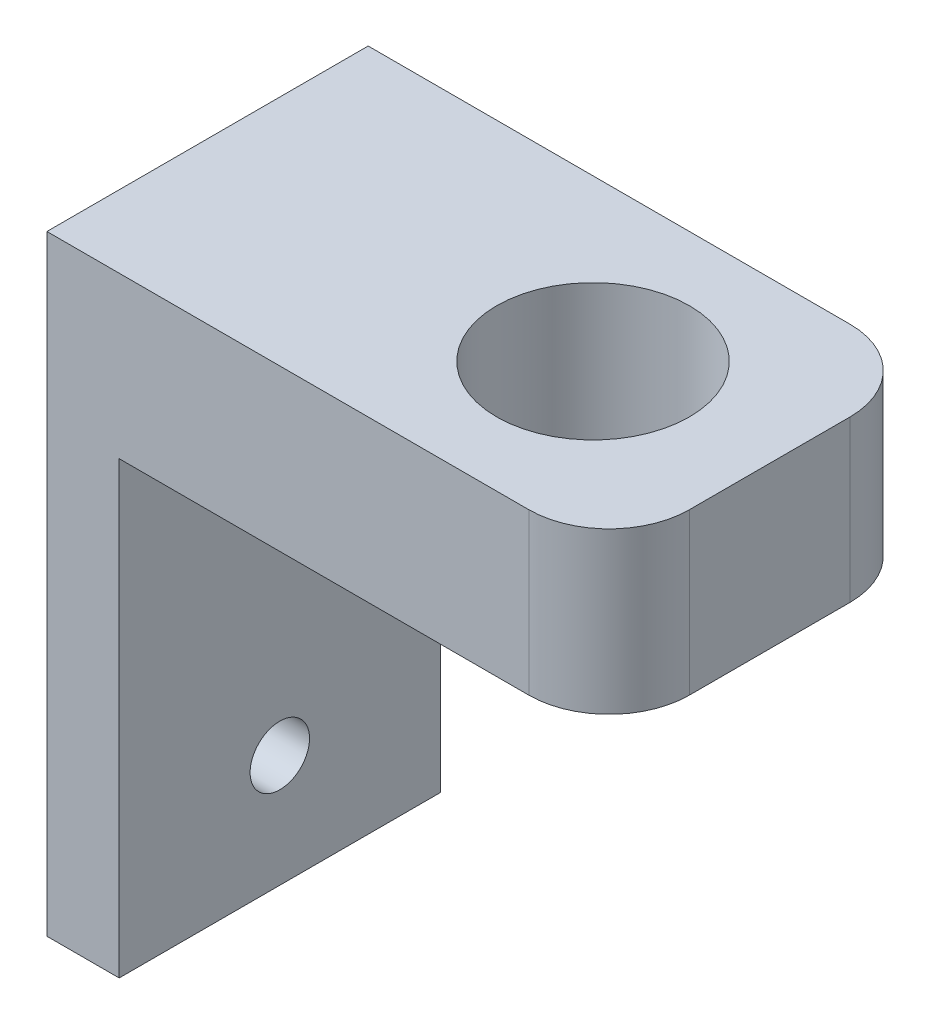
from build123d import *

# Parameters (mm, degrees)
SKETCH1_W           = 35
SKETCH1_H           = 20
BOSS_EXTRUDE1_DEPTH = 10
FILLET1_R           = 5
SKETCH4_R           = 6
CUT_EXTRUDE2_DEPTH  = 23.5
SKETCH5_W           = 4.5
SKETCH5_H           = 20
BOSS_EXTRUDE3_DEPTH = 28
SKETCH6_R           = 1.85
CUT_EXTRUDE3_DEPTH  = 43.594013664


with BuildPart() as part:
    # Sketch1 → Boss-Extrude1 (new body)
    with BuildSketch(Plane(origin=(0, 0, 0), x_dir=(1, 0, 0), z_dir=(0, 1, 0))):
        Rectangle(SKETCH1_W, SKETCH1_H)
    extrude(amount=BOSS_EXTRUDE1_DEPTH)

    # Fillet1
    fillet1_edges = [part.edges().sort_by_distance(p)[0] for p in [
        (17.5, 5, 10),
        (17.5, 5, -10),
    ]]
    fillet(fillet1_edges, radius=FILLET1_R)

    # Sketch4 → Cut-Extrude2 (cut, through all)
    with BuildSketch(Plane(origin=(0, 10, 0), x_dir=(1, 0, 0), z_dir=(0, 1, 0))):
        with Locations(Location((6.5, 0, 0), (0, 0, 270))):
            Circle(SKETCH4_R)
    extrude(amount=-CUT_EXTRUDE2_DEPTH, mode=Mode.SUBTRACT)

    # Sketch5 → Boss-Extrude3 (add)
    with BuildSketch(Plane.XZ):
        with Locations((-15.25, 0)):
            Rectangle(SKETCH5_W, SKETCH5_H)
    extrude(amount=BOSS_EXTRUDE3_DEPTH)

    # Sketch6 → Cut-Extrude3 (cut, through all)
    with BuildSketch(Plane(origin=(-13, 0, 0), x_dir=(0, 0, -1), z_dir=(1, 0, 0))):
        with Locations((0, -6)):
            Circle(SKETCH6_R)
        with Locations((0, -21)):
            Circle(SKETCH6_R)
    extrude(amount=-CUT_EXTRUDE3_DEPTH, mode=Mode.SUBTRACT)


solid = part.part
